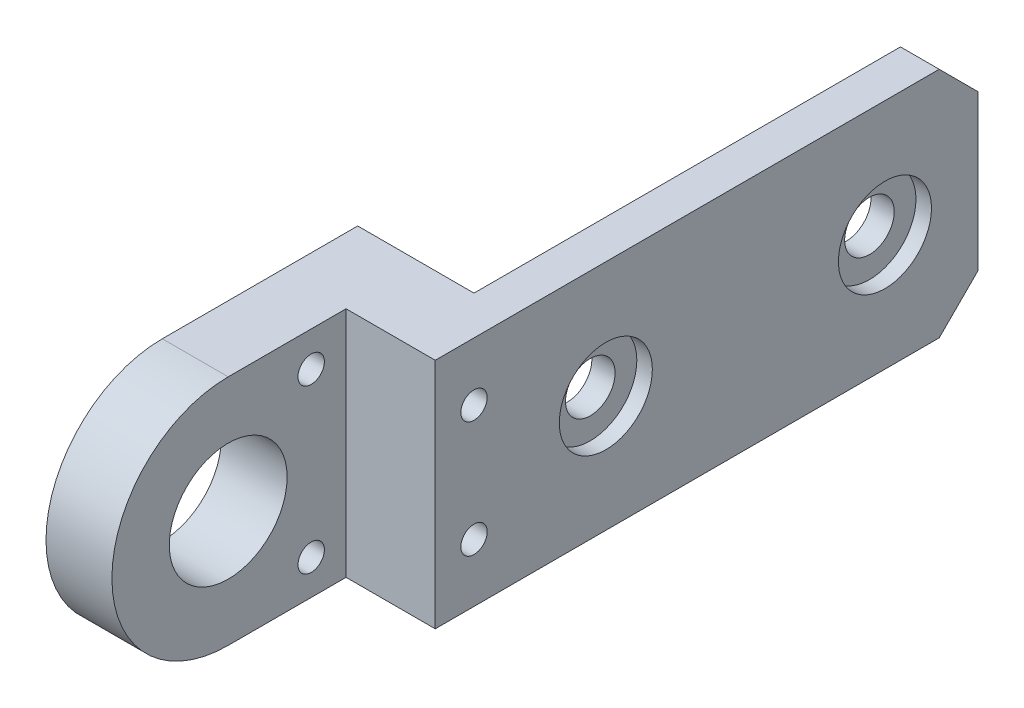
from build123d import *

# Parameters (mm, degrees)
SKETCH1_R           = 1.7
SKETCH1_R_2         = 7.6
BOSS_EXTRUDE1_DEPTH = 8.5
SKETCH1_4_W         = 30
SKETCH1_4_H         = 10
SKETCH1_4_R         = 1.7
BOSS_EXTRUDE2_DEPTH = 15
BOSS_EXTRUDE3_START = 15
SKETCH1_5_R         = 6
SKETCH1_5_W         = 30
SKETCH1_5_H         = 10
SKETCH1_5_R_2       = 1.7
SKETCH1_5_R_3       = 3.2
BOSS_EXTRUDE3_DEPTH = 3
BOSS_EXTRUDE4_START = 18
SKETCH1_6_R         = 6
SKETCH1_6_W         = 30
SKETCH1_6_H         = 10
SKETCH1_6_R_2       = 1.7
BOSS_EXTRUDE4_DEPTH = 2


with BuildPart() as part:
    # Sketch1 → Boss-Extrude1 (new body)
    with BuildSketch(Plane.YZ):
        with BuildLine():
            ThreePointArc((15, 0), (0, 15), (-15, 0))
            Line((-15, 0), (-15, -25.2))
            Line((-15, -25.2), (15, -25.2))
            Line((15, -25.2), (15, 0))
        make_face()
        with Locations(Location((-10.5, -10.7, 0), (0, 0, 270))):
            Circle(SKETCH1_R, mode=Mode.SUBTRACT)
        with Locations(Location((10.5, -10.7, 0), (0, 0, 270))):
            Circle(SKETCH1_R, mode=Mode.SUBTRACT)
        with Locations(Location((0, 0, 0), (0, 0, 270))):
            Circle(SKETCH1_R_2, mode=Mode.SUBTRACT)
        with Locations(Location((7.5, -20.2, 0), (0, 0, 270))):
            Circle(SKETCH1_R, mode=Mode.SUBTRACT)
        with Locations(Location((-7.5, -20.2, 0), (0, 0, 270))):
            Circle(SKETCH1_R, mode=Mode.SUBTRACT)
    extrude(amount=BOSS_EXTRUDE1_DEPTH)

    # Sketch1<4> → Boss-Extrude2 (add)
    with BuildSketch(Plane.YZ):
        with Locations((0, -20.2)):
            Rectangle(SKETCH1_4_W, SKETCH1_4_H)
        with Locations(Location((-7.5, -20.2, 0), (0, 0, 270))):
            Circle(SKETCH1_4_R, mode=Mode.SUBTRACT)
        with Locations(Location((7.5, -20.2, 0), (0, 0, 270))):
            Circle(SKETCH1_4_R, mode=Mode.SUBTRACT)
    extrude(amount=BOSS_EXTRUDE2_DEPTH)

    # Sketch1<5> → Boss-Extrude3 (add)
    # profile 1 of 4: a face of its own
    with BuildSketch(Plane.YZ.offset(BOSS_EXTRUDE3_START)):
        Polygon((15, -25.2), (-15, -25.2), (-15, -80.2), (-10, -85.2), (10, -85.2), (15, -80.2), align=None)
        with Locations((0, -73.2)):
            Circle(SKETCH1_5_R, mode=Mode.SUBTRACT)
        with Locations((0, -37.2)):
            Circle(SKETCH1_5_R, mode=Mode.SUBTRACT)
    # profile 2 of 4: a face of its own
    with BuildSketch(Plane.YZ.offset(BOSS_EXTRUDE3_START)):
        with Locations((0, -20.2)):
            Rectangle(SKETCH1_5_W, SKETCH1_5_H)
        with Locations(Location((-7.5, -20.2, 0), (0, 0, 270))):
            Circle(SKETCH1_5_R_2, mode=Mode.SUBTRACT)
        with Locations(Location((7.5, -20.2, 0), (0, 0, 270))):
            Circle(SKETCH1_5_R_2, mode=Mode.SUBTRACT)
    # profile 3 of 4: a face of its own
    with BuildSketch(Plane.YZ.offset(BOSS_EXTRUDE3_START)):
        with Locations((0, -37.2)):
            Circle(SKETCH1_5_R)
        with Locations(Location((0, -37.2, 0), (0, 0, 270))):
            Circle(SKETCH1_5_R_3, mode=Mode.SUBTRACT)
    # profile 4 of 4: a face of its own
    with BuildSketch(Plane.YZ.offset(BOSS_EXTRUDE3_START)):
        with Locations((0, -73.2)):
            Circle(SKETCH1_5_R)
        with Locations(Location((0, -73.2, 0), (0, 0, 270))):
            Circle(SKETCH1_5_R_3, mode=Mode.SUBTRACT)
    extrude(amount=BOSS_EXTRUDE3_DEPTH)

    # Sketch1<6> → Boss-Extrude4 (add)
    # profile 1 of 2: a face of its own
    with BuildSketch(Plane.YZ.offset(BOSS_EXTRUDE4_START)):
        Polygon((15, -25.2), (-15, -25.2), (-15, -80.2), (-10, -85.2), (10, -85.2), (15, -80.2), align=None)
        with Locations(Location((0, -73.2, 0), (0, 0, 270))):
            Circle(SKETCH1_6_R, mode=Mode.SUBTRACT)
        with Locations(Location((0, -37.2, 0), (0, 0, 270))):
            Circle(SKETCH1_6_R, mode=Mode.SUBTRACT)
    # profile 2 of 2: a face of its own
    with BuildSketch(Plane.YZ.offset(BOSS_EXTRUDE4_START)):
        with Locations((0, -20.2)):
            Rectangle(SKETCH1_6_W, SKETCH1_6_H)
        with Locations(Location((-7.5, -20.2, 0), (0, 0, 270))):
            Circle(SKETCH1_6_R_2, mode=Mode.SUBTRACT)
        with Locations(Location((7.5, -20.2, 0), (0, 0, 270))):
            Circle(SKETCH1_6_R_2, mode=Mode.SUBTRACT)
    extrude(amount=BOSS_EXTRUDE4_DEPTH)


solid = part.part
